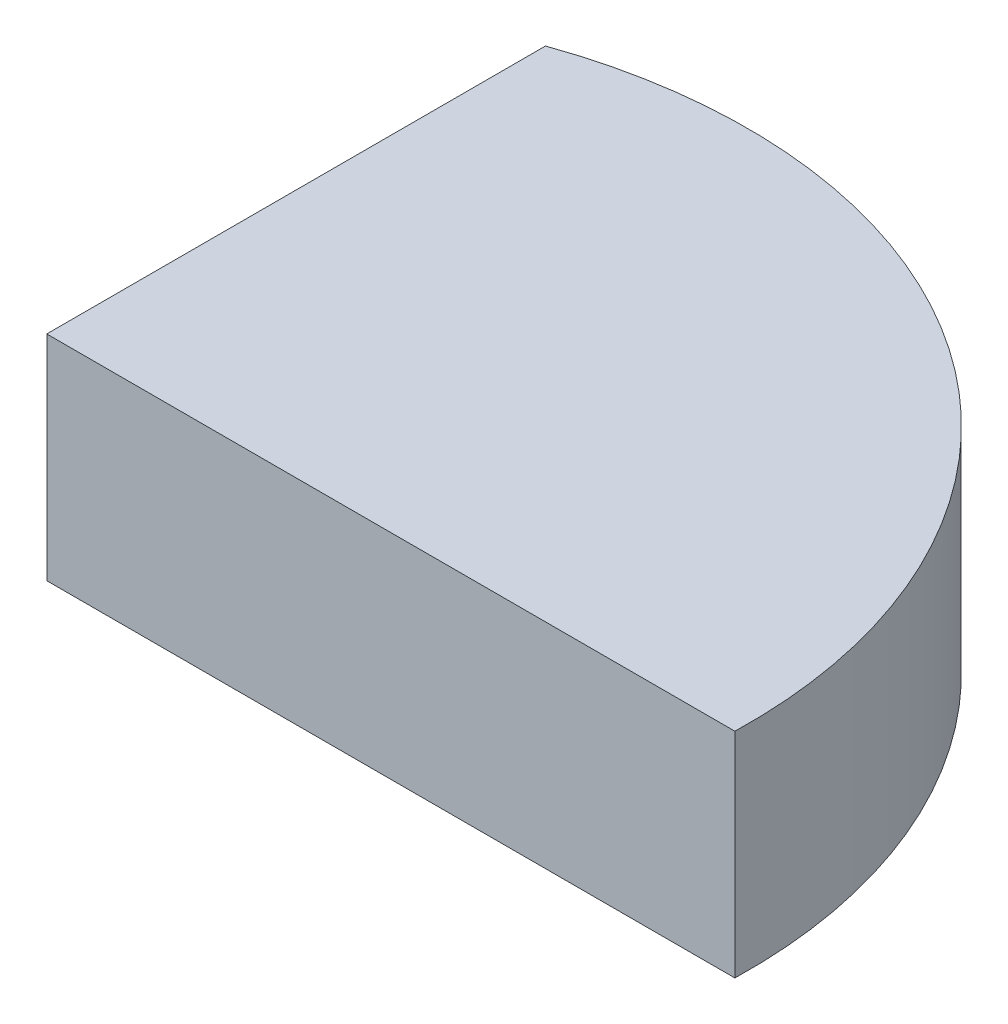
from build123d import *

# Parameters (mm, degrees)
BOSS_EXTRUDE1_DEPTH = 19.05


with BuildPart() as part:
    # Sketch1 → Boss-Extrude1 (new body)
    with BuildSketch(Plane(origin=(0, 0, 0), x_dir=(1, 0, 0), z_dir=(0, 1, 0))):
        with BuildLine():
            Line((0, 0), (0, 44.45))
            ThreePointArc((0, 44.45), (42.358540688, 38.357936562), (61.332942098, 0))
            Line((61.332942098, 0), (0, 0))
        make_face()
    extrude(amount=BOSS_EXTRUDE1_DEPTH)


solid = part.part
